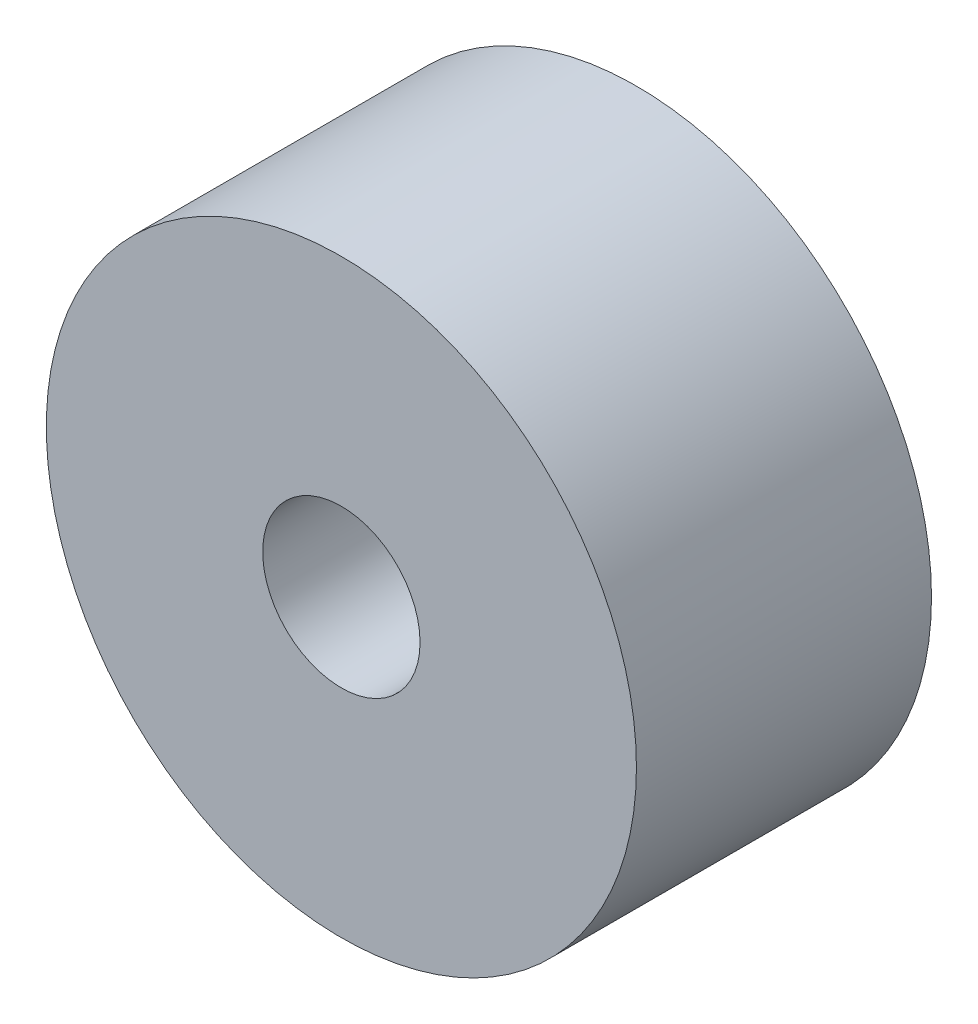
from build123d import *

# Parameters (mm, degrees)
SKETCH_1_R      = 30
SKETCH_1_R_2    = 8
EXTRUDE_1_DEPTH = 30


with BuildPart() as part:
    # 草图1 → 凸台-拉伸1 (new body)
    with BuildSketch(Plane.XY):
        Circle(SKETCH_1_R)
        Circle(SKETCH_1_R_2, mode=Mode.SUBTRACT)
    extrude(amount=EXTRUDE_1_DEPTH)


solid = part.part
